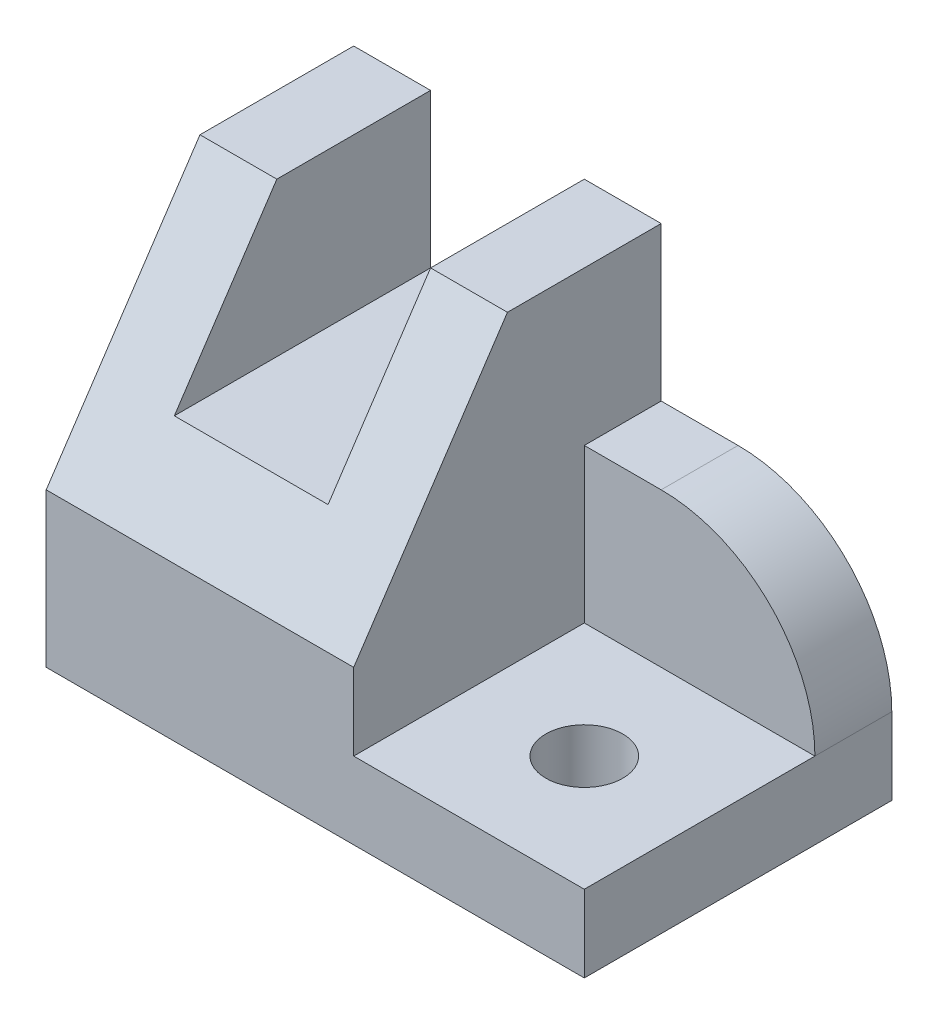
from build123d import *

# Parameters (mm, degrees)
EXTRUDE_1_DEPTH          = 20
SKETCH_3_W               = 35
SKETCH_3_H               = 20
EXTRUDE_2_DEPTH          = 5
SKETCH_4_W               = 15
SKETCH_4_H               = 10
EXTRUDE_3_DEPTH          = 5
FILLET_1_R               = 10
CUT_EXTRUDE_1_DEPTH      = 46
CUT_EXTRUDE_1_DEPTH_BACK = 46
SKETCH_5_W               = 10
SKETCH_5_H               = 20
SKETCH_6_R               = 2.5
CUT_EXTRUDE_2_DEPTH      = 5


with BuildPart() as part:
    # 草圖1 → 填料-伸長1 (new body)
    with BuildSketch(Plane(origin=(0, 0, 0), x_dir=(0, 0, -1), z_dir=(1, 0, 0))):
        Polygon((-10, 20), (-20, 5), (-20, 0), (0, 0), (0, 20), align=None)
    extrude(amount=EXTRUDE_1_DEPTH)

    # 草圖3 → 填料-伸長2 (add)
    with BuildSketch(Plane.XZ):
        with Locations((17.5, 10)):
            Rectangle(SKETCH_3_W, SKETCH_3_H)
    extrude(amount=EXTRUDE_2_DEPTH)

    # 草圖4 → 填料-伸長3 (add)
    with BuildSketch(Plane(origin=(0, 0, 0), x_dir=(-1, 0, 0), z_dir=(0, 0, -1))):
        with Locations((-27.5, 5)):
            Rectangle(SKETCH_4_W, SKETCH_4_H)
    extrude(amount=-EXTRUDE_3_DEPTH)

    # 圓角1
    fillet_1_edges = [part.edges().sort_by_distance(p)[0] for p in [
        (35, 10, 2.5),
    ]]
    fillet(fillet_1_edges, radius=FILLET_1_R)

    # 草圖5 → 除料-伸長1 (cut, two sides: drawn at the far end of the back side and taken through both)
    with BuildSketch(Plane.XY.offset(-CUT_EXTRUDE_1_DEPTH_BACK)):
        with Locations((10, 20)):
            Rectangle(SKETCH_5_W, SKETCH_5_H)
    extrude(amount=CUT_EXTRUDE_1_DEPTH + CUT_EXTRUDE_1_DEPTH_BACK, mode=Mode.SUBTRACT)

    # 草圖6 → 除料-伸長2 (cut)
    with BuildSketch(Plane(origin=(0, 0, 0), x_dir=(1, 0, 0), z_dir=(0, 1, 0))):
        with Locations(Location((27.5, -12.5, 0), (0, 0, 270))):
            Circle(SKETCH_6_R)
    extrude(amount=-CUT_EXTRUDE_2_DEPTH, mode=Mode.SUBTRACT)


solid = part.part
